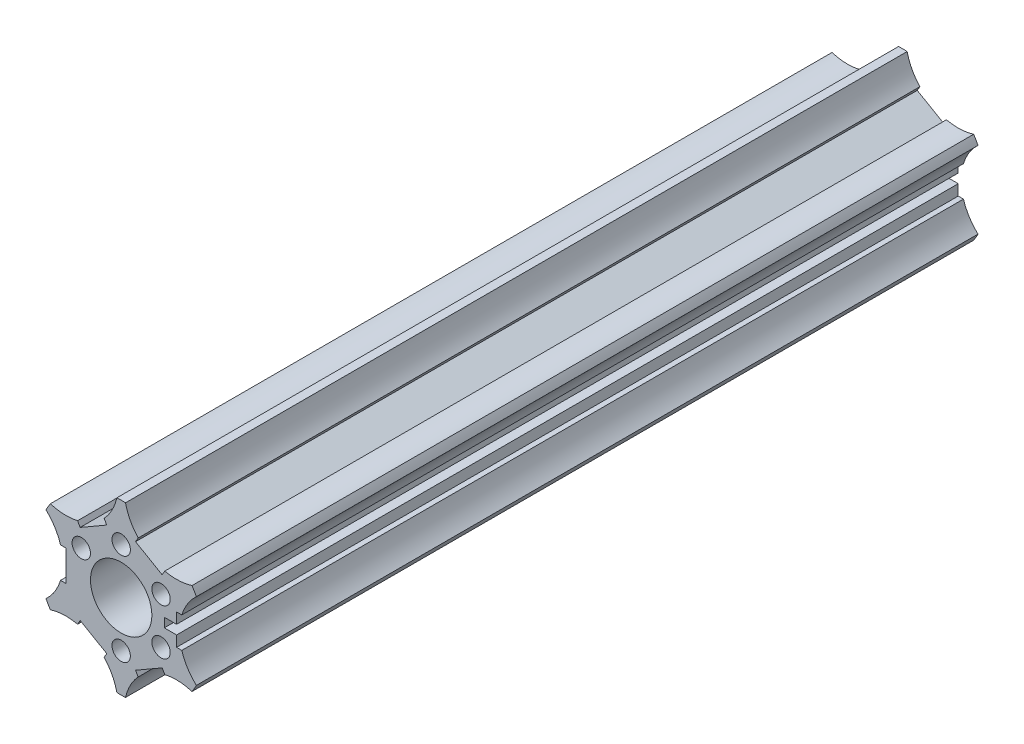
from build123d import *

# Parameters (mm, degrees)
BOSS_EXTRU_1_DEPTH      = 254.666666667
ESQUISSE4_R             = 54.250129783
ESQUISSE4_R_2           = 27.5
ENL_V_MAT_EXTRU_1_DEPTH = 266.174026394
ESQUISSE5_R             = 10
ESQUISSE5_R_2           = 3
ESQUISSE5_W             = 1.7
ESQUISSE5_H             = 10
ENL_V_MAT_EXTRU_2_DEPTH = 258.315177949


with BuildPart() as part:
    # Esquisse1 → Boss.-Extru.1 (new body)
    with BuildSketch(Plane.XY):
        with BuildLine():
            Line((-18, -51.176914536), (-18, -48.176914536))
            ThreePointArc((-18, -48.176914536), (-9.5, -16.454482672), (-32.722431864, -39.676914536))
            Line((-32.722431864, -39.676914536), (-35.320508076, -41.176914536))
            ThreePointArc((-35.320508076, -41.176914536), (-37.98683472, -30.451354144), (-34.549834435, -19.947356212))
            ThreePointArc((-34.549834435, -19.947356212), (-45.365063628, -17.671886805), (-53.320508076, -10))
            Line((-53.320508076, -10), (-50.722431864, -8.5))
            ThreePointArc((-50.722431864, -8.5), (-19, 0), (-50.722431864, 8.5))
            Line((-50.722431864, 8.5), (-53.320508076, 10))
            ThreePointArc((-53.320508076, 10), (-45.365063628, 17.671886805), (-34.549834435, 19.947356212))
            ThreePointArc((-34.549834435, 19.947356212), (-37.98683472, 30.451354144), (-35.320508076, 41.176914536))
            Line((-35.320508076, 41.176914536), (-32.722431864, 39.676914536))
            ThreePointArc((-32.722431864, 39.676914536), (-9.5, 16.454482672), (-18, 48.176914536))
            Line((-18, 48.176914536), (-18, 51.176914536))
            ThreePointArc((-18, 51.176914536), (-7.378228908, 48.123240948), (0, 39.894712423))
            ThreePointArc((0, 39.894712423), (7.378228908, 48.123240948), (18, 51.176914536))
            Line((18, 51.176914536), (18, 48.176914536))
            ThreePointArc((18, 48.176914536), (9.5, 16.454482672), (32.722431864, 39.676914536))
            Line((32.722431864, 39.676914536), (35.320508076, 41.176914536))
            ThreePointArc((35.320508076, 41.176914536), (37.98683472, 30.451354144), (34.549834435, 19.947356212))
            ThreePointArc((34.549834435, 19.947356212), (45.365063628, 17.671886805), (53.320508076, 10))
            Line((53.320508076, 10), (50.722431864, 8.5))
            ThreePointArc((50.722431864, 8.5), (19, 0), (50.722431864, -8.5))
            Line((50.722431864, -8.5), (53.320508076, -10))
            ThreePointArc((53.320508076, -10), (45.365063628, -17.671886805), (34.549834435, -19.947356212))
            ThreePointArc((34.549834435, -19.947356212), (37.98683472, -30.451354144), (35.320508076, -41.176914536))
            Line((35.320508076, -41.176914536), (32.722431864, -39.676914536))
            ThreePointArc((32.722431864, -39.676914536), (9.5, -16.454482672), (18, -48.176914536))
            Line((18, -48.176914536), (18, -51.176914536))
            ThreePointArc((18, -51.176914536), (7.378228908, -48.123240948), (0, -39.894712423))
            ThreePointArc((0, -39.894712423), (-7.378228908, -48.123240948), (-18, -51.176914536))
        make_face()
    extrude(amount=BOSS_EXTRU_1_DEPTH)

    # Esquisse4 → Enlèv. mat.-Extru.1 (cut, through all)
    with BuildSketch(Plane.XY.offset(254.666666667)):
        Circle(ESQUISSE4_R)
        Circle(ESQUISSE4_R_2, mode=Mode.SUBTRACT)
    extrude(amount=-ENL_V_MAT_EXTRU_1_DEPTH, mode=Mode.SUBTRACT)

    # Esquisse5 → Enlèv. mat.-Extru.2 (cut, through all)
    with BuildSketch(Plane.XY.offset(254.666666667)):
        Circle(ESQUISSE5_R)
        with Locations((0, 15)):
            Circle(ESQUISSE5_R_2)
        with Locations((12.990381057, 7.5)):
            Circle(ESQUISSE5_R_2)
        with Locations((12.990381057, -7.5)):
            Circle(ESQUISSE5_R_2)
        with Locations((0, -15)):
            Circle(ESQUISSE5_R_2)
        with Locations((-12.990381057, 7.5)):
            Circle(ESQUISSE5_R_2)
        Polygon((14.206088614, -14.605667257), (5.545834576, -19.605667257), (4.695834576, -18.13342407), (13.356088614, -13.13342407), align=None)
        Polygon((18.051923191, 5), (19.751923191, 5), (19.751923191, -5), (18.051923191, -5), (18.051923191, -1.5), (14.051923191, -1.5), (14.051923191, 1.5), (18.051923191, 1.5), align=None)
        Polygon((-5.545834576, -19.605667257), (-14.206088614, -14.605667257), (-13.356088614, -13.13342407), (-4.695834576, -18.13342407), align=None)
        with Locations((-18.901923191, 0)):
            Rectangle(ESQUISSE5_W, ESQUISSE5_H)
        Polygon((-14.206088614, 14.605667257), (-5.545834576, 19.605667257), (-4.695834576, 18.13342407), (-13.356088614, 13.13342407), align=None)
        Polygon((5.545834576, 19.605667257), (14.206088614, 14.605667257), (13.356088614, 13.13342407), (4.695834576, 18.13342407), align=None)
    extrude(amount=-ENL_V_MAT_EXTRU_2_DEPTH, mode=Mode.SUBTRACT)


solid = part.part
